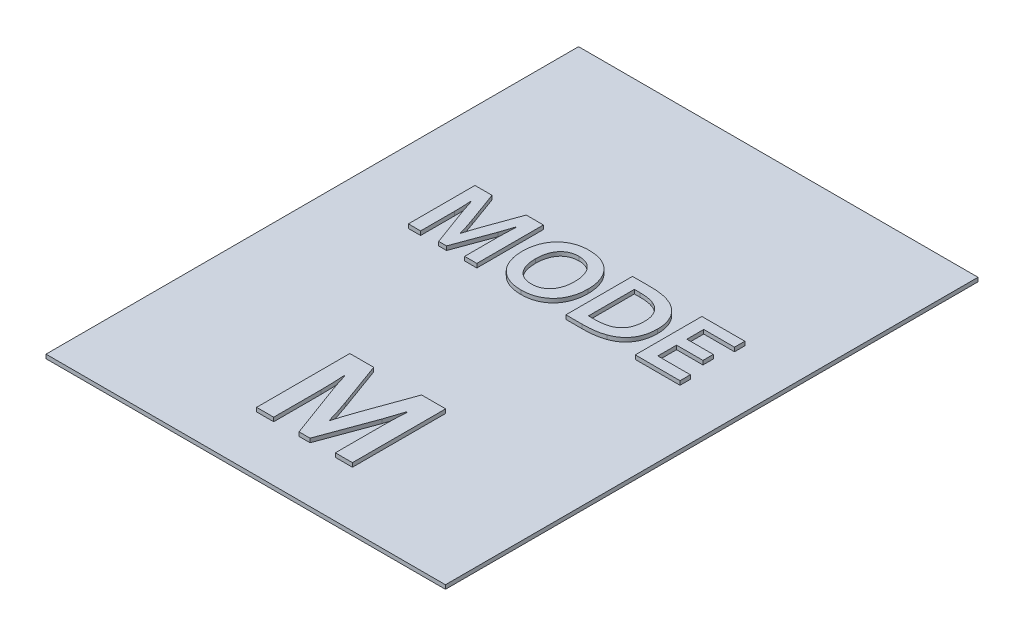
from build123d import *

# Parameters (mm, degrees)
SKETCH1_W           = 15
SKETCH1_H           = 20
BOSS_EXTRUDE1_DEPTH = 0.15
BOSS_EXTRUDE2_DEPTH = 0.15


with BuildPart() as part:
    # Sketch1 → Boss-Extrude1 (new body)
    with BuildSketch(Plane(origin=(0, 0, 0), x_dir=(1, 0, 0), z_dir=(0, 1, 0))):
        with Locations((7.5, 10)):
            Rectangle(SKETCH1_W, SKETCH1_H)
    extrude(amount=BOSS_EXTRUDE1_DEPTH)

    # Sketch2 → Boss-Extrude2 (add)
    # profile 1 of 5: a face of its own
    with BuildSketch(Plane(origin=(0, 0.15, 0), x_dir=(1, 0, 0), z_dir=(0, 1, 0))):
        with BuildLine():
            add(Edge.make_bspline(
                [(4.007118805, 11.561710579), (4.021341988, 11.611856052), (4.05041214, 11.714346222), (4.100009995, 11.869769118), (4.15291887, 12.031022762), (4.191561657, 12.139658429), (4.211234122, 12.19496322)],
                knots=[0, 0, 0, 0, 0.939842652, 1.920903895, 2.941563291, 4, 4, 4, 4], degree=3))
            Line((4.211234122, 12.19496322), (4.644222678, 13.391045967))
            Line((4.644222678, 13.391045967), (5.28847884, 13.391045967))
            Line((5.28847884, 13.391045967), (5.28847884, 10.891045967))
            Line((5.28847884, 10.891045967), (4.830732361, 10.891045967))
            Line((4.830732361, 10.891045967), (4.830732361, 12.158101424))
            add(Edge.make_bspline(
                [(4.830732361, 12.158101424), (4.831168475, 12.206334896), (4.832075637, 12.306665611), (4.835791365, 12.46276872), (4.843308015, 12.630009749), (4.849529089, 12.745144369), (4.852739403, 12.804558291)],
                knots=[0, 0, 0, 0, 0.894747737, 1.861169783, 2.896280781, 4, 4, 4, 4], degree=3))
            Line((4.852739403, 12.804558291), (4.836234122, 12.804558291))
            add(Edge.make_bspline(
                [(4.836234122, 12.804558291), (4.824814517, 12.766737473), (4.800637232, 12.686664237), (4.760299667, 12.563219814), (4.717428899, 12.433900638), (4.686558981, 12.347124918), (4.671181305, 12.303898079)],
                knots=[0, 0, 0, 0, 0.899185574, 1.903731904, 2.955755803, 4, 4, 4, 4], degree=3))
            Line((4.671181305, 12.303898079), (4.151264931, 10.891045967))
            Line((4.151264931, 10.891045967), (3.855270213, 10.891045967))
            Line((3.855270213, 10.891045967), (3.33535384, 12.303898079))
            add(Edge.make_bspline(
                [(3.33535384, 12.303898079), (3.320047882, 12.347148821), (3.289302405, 12.43402771), (3.245362218, 12.562993107), (3.206066125, 12.686777658), (3.181779815, 12.766756654), (3.170301023, 12.804558291)],
                knots=[0, 0, 0, 0, 1.044229383, 2.097570722, 3.100827182, 4, 4, 4, 4], degree=3))
            Line((3.170301023, 12.804558291), (3.153245565, 12.804558291))
            add(Edge.make_bspline(
                [(3.153245565, 12.804558291), (3.156705648, 12.747899151), (3.163500161, 12.636638457), (3.170803503, 12.472489686), (3.174509644, 12.314185105), (3.175377403, 12.210553046), (3.175802784, 12.159751953)],
                knots=[0, 0, 0, 0, 1.055577018, 2.072820593, 3.055284423, 4, 4, 4, 4], degree=3))
            Line((3.175802784, 12.159751953), (3.175802784, 10.891045967))
            Line((3.175802784, 10.891045967), (2.718056305, 10.891045967))
            Line((2.718056305, 10.891045967), (2.718056305, 13.391045967))
            Line((2.718056305, 13.391045967), (3.35901141, 13.391045967))
            Line((3.35901141, 13.391045967), (3.791449791, 12.201015157))
            add(Edge.make_bspline(
                [(3.791449791, 12.201015157), (3.809403487, 12.150639986), (3.845853326, 12.048367627), (3.898267901, 11.891513646), (3.948183789, 11.72869774), (3.97962566, 11.61788637), (3.995565107, 11.561710579)],
                knots=[0, 0, 0, 0, 0.956008945, 1.940902413, 2.956141108, 4, 4, 4, 4], degree=3))
            Line((3.995565107, 11.561710579), (4.007118805, 11.561710579))
        make_face()
    # profile 2 of 5: a face of its own
    with BuildSketch(Plane(origin=(0, 0.15, 0), x_dir=(1, 0, 0), z_dir=(0, 1, 0))):
        with BuildLine():
            add(Edge.make_bspline(
                [(8.211014051, 12.141045967), (8.210147117, 12.094785664), (8.208446047, 12.004015145), (8.192571627, 11.870774254), (8.167033635, 11.743308394), (8.130576769, 11.622245965), (8.085170064, 11.508049597), (8.029874149, 11.401565907), (7.96489408, 11.303354273), (7.890223995, 11.213615962), (7.80625788, 11.133234992), (7.713650448, 11.061292854), (7.611365444, 11.000085108), (7.500962753, 10.947253873), (7.381777038, 10.906002641), (7.254276069, 10.877160108), (7.119058203, 10.859208259), (7.026175645, 10.85697707), (6.978619685, 10.855834699)],
                knots=[0, 0, 0, 0, 1.10397319, 2.166181668, 3.19823321, 4.203814349, 5.180208902, 6.127974338, 7.062953007, 7.986182927, 8.908904057, 9.832766977, 10.779571297, 11.748942224, 12.749986143, 13.783327641, 14.865061606, 16, 16, 16, 16], degree=3))
            add(Edge.make_bspline(
                [(6.978619685, 10.855834699), (6.931063561, 10.856976815), (6.838180683, 10.859207505), (6.702965098, 10.877162906), (6.575456003, 10.905992787), (6.456299157, 10.947288967), (6.345935231, 10.999892262), (6.244019304, 11.061650104), (6.151003114, 11.133019961), (6.067034074, 11.213645162), (5.992353866, 11.303351543), (5.927310857, 11.401546833), (5.872252281, 11.508191917), (5.825794124, 11.622006391), (5.790434108, 11.743436063), (5.764601351, 11.870753029), (5.748810891, 12.004020761), (5.747098183, 12.09478756), (5.746225319, 12.141045967)],
                knots=[0, 0, 0, 0, 1.13493026, 2.216656473, 3.249990565, 4.25102731, 5.22039129, 6.163446387, 7.090771268, 8.013485786, 8.936709089, 9.871681058, 10.819439701, 11.79746504, 12.80178971, 13.833833857, 14.896034721, 16, 16, 16, 16], degree=3))
            add(Edge.make_bspline(
                [(5.746225319, 12.141045967), (5.747111553, 12.187302543), (5.748853985, 12.278247971), (5.764481637, 12.411542646), (5.79052235, 12.538821448), (5.825784352, 12.660087392), (5.872254756, 12.773899596), (5.927310305, 12.88054502), (5.992353669, 12.978741105), (6.067035383, 13.06844403), (6.15099806, 13.149082257), (6.244038448, 13.220402945), (6.34579451, 13.282308455), (6.456442098, 13.334157038), (6.575515918, 13.375425364), (6.702883887, 13.40510903), (6.838191439, 13.422834481), (6.931067204, 13.425098205), (6.978619685, 13.426257234)],
                knots=[0, 0, 0, 0, 1.104021813, 2.170626186, 3.19843321, 4.202809312, 5.180884735, 6.128691913, 7.063711762, 7.986982344, 8.909744114, 9.837116483, 10.780219874, 11.74776306, 12.748851068, 13.783230012, 14.86501162, 16, 16, 16, 16], degree=3))
            add(Edge.make_bspline(
                [(6.978619685, 13.426257234), (7.026172002, 13.425097949), (7.119047446, 13.422833725), (7.254357283, 13.405111835), (7.381717106, 13.375415479), (7.500819829, 13.334192175), (7.611506665, 13.282116544), (7.713631369, 13.22076032), (7.806262921, 13.148867203), (7.890222687, 13.068473231), (7.964894279, 12.978738375), (8.029874694, 12.880525944), (8.085167619, 12.774041925), (8.13058642, 12.65984778), (8.166944193, 12.538948742), (8.192691146, 12.411521359), (8.20840298, 12.278253596), (8.210133749, 12.18730444), (8.211014051, 12.141045967)],
                knots=[0, 0, 0, 0, 1.134996515, 2.216785876, 3.251172233, 4.252267416, 5.219817536, 6.166670343, 7.090580574, 8.013348957, 8.936626156, 9.871652706, 10.819466677, 11.795911232, 12.801543866, 13.829358257, 14.895970275, 16, 16, 16, 16], degree=3))
        make_face()
        with BuildLine():
            add(Edge.make_bspline(
                [(7.718056305, 12.141045967), (7.717508206, 12.177384681), (7.716445537, 12.247839168), (7.705815337, 12.350122415), (7.688520316, 12.445295702), (7.664148515, 12.533409626), (7.634040847, 12.614473334), (7.598079761, 12.688687997), (7.557151631, 12.756212453), (7.50975575, 12.815797198), (7.458588812, 12.869199293), (7.402278065, 12.91510631), (7.340935992, 12.953354001), (7.275437188, 12.984767708), (7.205745826, 13.008815753), (7.133016217, 13.026461117), (7.056886151, 13.0372681), (7.005064078, 13.038370662), (6.978619685, 13.038933291)],
                knots=[0, 0, 0, 0, 1.326027526, 2.570938252, 3.748651103, 4.853004742, 5.903648558, 6.900610549, 7.859261004, 8.779270952, 9.673995906, 10.554280722, 11.42350071, 12.306758397, 13.200155178, 14.109361998, 15.035222432, 16, 16, 16, 16], degree=3))
            add(Edge.make_bspline(
                [(6.978619685, 13.038933291), (6.95217531, 13.038370645), (6.900353271, 13.037268051), (6.824222954, 13.026461302), (6.751494269, 13.008815079), (6.681799537, 12.984770169), (6.616313064, 12.95334499), (6.554925587, 12.915139537), (6.498687606, 12.868991218), (6.446864541, 12.816176873), (6.400185698, 12.755987192), (6.359115001, 12.688724557), (6.32321138, 12.614462797), (6.293087142, 12.533412669), (6.268720143, 12.44529481), (6.251423717, 12.350122675), (6.24079392, 12.247839096), (6.239731194, 12.177384656), (6.239183065, 12.141045967)],
                knots=[0, 0, 0, 0, 0.964744669, 1.890573531, 2.799749348, 3.693115665, 4.576343233, 5.44553358, 6.325788378, 7.225153193, 8.141006995, 9.09962476, 10.096552755, 11.147160744, 12.251476725, 13.429149416, 14.674017691, 16, 16, 16, 16], degree=3))
            add(Edge.make_bspline(
                [(6.239183065, 12.141045967), (6.239732702, 12.104707672), (6.240798353, 12.034253997), (6.251407612, 11.931965044), (6.268807312, 11.836637527), (6.292998534, 11.74828988), (6.323106322, 11.667213135), (6.359094903, 11.593332824), (6.400373525, 11.526598812), (6.446668753, 11.466465944), (6.498861219, 11.414169047), (6.555074665, 11.368130544), (6.616121184, 11.329140481), (6.681954139, 11.298123265), (6.75127263, 11.272877209), (6.824382437, 11.256602658), (6.900282907, 11.244568306), (6.952160276, 11.243634777), (6.978619685, 11.243158643)],
                knots=[0, 0, 0, 0, 1.326383379, 2.571628189, 3.749657091, 4.860761826, 5.911687593, 6.902896967, 7.856106969, 8.77223779, 9.667102655, 10.547623704, 11.420653433, 12.304148151, 13.200014488, 14.107911086, 15.034963524, 16, 16, 16, 16], degree=3))
            add(Edge.make_bspline(
                [(6.978619685, 11.243158643), (7.005079111, 11.243634761), (7.056956515, 11.244568257), (7.132856734, 11.256602844), (7.205967463, 11.27287653), (7.275282585, 11.298125747), (7.341127867, 11.3291314), (7.402128902, 11.368164128), (7.458414037, 11.413960225), (7.509953559, 11.466845798), (7.556962311, 11.526374439), (7.598100252, 11.593369135), (7.634145874, 11.667202601), (7.664237097, 11.74829295), (7.68843315, 11.836636631), (7.705831441, 11.931965304), (7.716441104, 12.034253926), (7.717506697, 12.104707648), (7.718056305, 12.141045967)],
                knots=[0, 0, 0, 0, 0.965070905, 1.892156417, 2.800085406, 3.695983705, 4.579509943, 5.452570818, 6.333123281, 7.223323078, 8.143612752, 9.096856762, 10.088101498, 11.139064759, 12.250209134, 13.428280064, 14.6735693, 16, 16, 16, 16], degree=3))
        make_face(mode=Mode.SUBTRACT)
    # profile 3 of 5: a face of its own
    with BuildSketch(Plane(origin=(0, 0.15, 0), x_dir=(1, 0, 0), z_dir=(0, 1, 0))):
        with BuildLine():
            Line((8.633549262, 10.891045967), (8.633549262, 13.391045967))
            Line((8.633549262, 13.391045967), (9.304764051, 13.391045967))
            add(Edge.make_bspline(
                [(9.304764051, 13.391045967), (9.334663027, 13.39091661), (9.395044312, 13.390655374), (9.485853831, 13.385887703), (9.576153443, 13.379078446), (9.664538801, 13.3688892), (9.750297348, 13.357075276), (9.832708948, 13.342293642), (9.910806888, 13.325376469), (9.960292541, 13.310307492), (9.984231481, 13.303017798)],
                knots=[0, 0, 0, 0, 1.043593946, 2.10754854, 3.173523578, 4.204294749, 5.212878915, 6.194903184, 7.126775134, 8, 8, 8, 8], degree=3))
            add(Edge.make_bspline(
                [(9.984231481, 13.303017798), (10.017210167, 13.291885144), (10.081953721, 13.270029588), (10.175052727, 13.230532909), (10.261387155, 13.183793332), (10.342677312, 13.132867937), (10.417590686, 13.076142253), (10.486111508, 13.014166139), (10.54861414, 12.94758019), (10.604145316, 12.875636442), (10.653952116, 12.799639428), (10.696833682, 12.719090557), (10.733369304, 12.634234784), (10.763539087, 12.545196042), (10.787218528, 12.451922692), (10.804090005, 12.354815648), (10.814983492, 12.25389714), (10.816087057, 12.185272044), (10.816647854, 12.15039896)],
                knots=[0, 0, 0, 0, 1.089186224, 2.138283641, 3.160292024, 4.158706084, 5.137912795, 6.096978333, 7.047244128, 7.992138446, 8.937782078, 9.887874514, 10.844274186, 11.826235823, 12.827154491, 13.85289531, 14.908909893, 16, 16, 16, 16], degree=3))
            add(Edge.make_bspline(
                [(10.816647854, 12.15039896), (10.81619813, 12.117182269), (10.815314415, 12.051911022), (10.805975114, 11.955481703), (10.792032271, 11.862269136), (10.772025249, 11.772249398), (10.747161453, 11.685536939), (10.714856938, 11.602992293), (10.677529955, 11.523910867), (10.634044617, 11.448905717), (10.584161993, 11.378184175), (10.528566438, 11.31142004), (10.46664656, 11.249105936), (10.398866467, 11.191166317), (10.324484504, 11.138011044), (10.243734334, 11.089787046), (10.156348741, 11.046498631), (10.094834967, 11.022616453), (10.063456833, 11.010434171)],
                knots=[0, 0, 0, 0, 1.086887555, 2.135748769, 3.168058729, 4.170063808, 5.152092151, 6.117449806, 7.067931046, 8.012022167, 8.951272991, 9.89736566, 10.852385093, 11.823139696, 12.812606439, 13.84101728, 14.898704396, 16, 16, 16, 16], degree=3))
            add(Edge.make_bspline(
                [(10.063456833, 11.010434171), (10.035877938, 11.000723171), (9.979251234, 10.980783939), (9.890151096, 10.957133336), (9.795742531, 10.936825713), (9.695916187, 10.919736571), (9.590197179, 10.90639559), (9.477974686, 10.898308968), (9.359495104, 10.891566868), (9.278183168, 10.891222383), (9.23654222, 10.891045967)],
                knots=[0, 0, 0, 0, 0.835398993, 1.715293255, 2.632340385, 3.594875658, 4.609085711, 5.676420896, 6.810063539, 8, 8, 8, 8], degree=3))
            Line((9.23654222, 10.891045967), (8.633549262, 10.891045967))
        make_face()
        with BuildLine():
            add(Edge.make_bspline(
                [(9.281656657, 11.27836991), (9.314489143, 11.278683359), (9.378359464, 11.279293124), (9.471448983, 11.284103457), (9.559002381, 11.292938607), (9.641086715, 11.304934622), (9.717567847, 11.320093019), (9.788417345, 11.339029384), (9.854231096, 11.36038236), (9.895064491, 11.378870036), (9.914909298, 11.387854946)],
                knots=[0, 0, 0, 0, 1.216660131, 2.36681661, 3.452842549, 4.476429291, 5.440052605, 6.340109689, 7.193302415, 8, 8, 8, 8], degree=3))
            add(Edge.make_bspline(
                [(9.914909298, 11.387854946), (9.931398167, 11.396178779), (9.964020486, 11.412647024), (10.009433605, 11.442179342), (10.052413658, 11.473765149), (10.09223102, 11.508078953), (10.129054207, 11.545411309), (10.162386288, 11.585457219), (10.193003518, 11.628247535), (10.220477924, 11.673839239), (10.244813178, 11.722816874), (10.266332742, 11.774734185), (10.283633304, 11.830296058), (10.298879008, 11.888561303), (10.30939196, 11.950469471), (10.317812428, 12.015416746), (10.322780441, 12.083750633), (10.323382382, 12.130401357), (10.323690107, 12.154250192)],
                knots=[0, 0, 0, 0, 0.961643136, 1.902557943, 2.817899626, 3.739205806, 4.637788669, 5.546725084, 6.450827767, 7.376631405, 8.316672613, 9.297862575, 10.30104246, 11.346161031, 12.433195875, 13.569702801, 14.75758074, 16, 16, 16, 16], degree=3))
            add(Edge.make_bspline(
                [(10.323690107, 12.154250192), (10.323211455, 12.179016024), (10.322273965, 12.227522446), (10.316608046, 12.29838448), (10.305227757, 12.365383385), (10.290634913, 12.42869271), (10.271684271, 12.488583752), (10.24939173, 12.545192506), (10.222803054, 12.598351781), (10.192447455, 12.647929937), (10.158765003, 12.694264844), (10.122010789, 12.737566253), (10.080747277, 12.776543823), (10.036834096, 12.81304111), (9.989422461, 12.845986772), (9.939058333, 12.875603717), (9.886211418, 12.903040873), (9.849023765, 12.918011813), (9.830182185, 12.925597023)],
                knots=[0, 0, 0, 0, 1.211129113, 2.372120613, 3.47189722, 4.531188705, 5.546525523, 6.540652967, 7.503134403, 8.448971039, 9.379896832, 10.301969689, 11.221597421, 12.151615773, 13.091952693, 14.040845077, 15.007370132, 16, 16, 16, 16], degree=3))
            add(Edge.make_bspline(
                [(9.830182185, 12.925597023), (9.792464865, 12.938238416), (9.714154299, 12.964485102), (9.610235053, 12.983045181), (9.521306788, 12.993830951), (9.449371996, 12.999929014), (9.373382325, 13.003087644), (9.321455488, 13.003507164), (9.294860882, 13.003722023)],
                knots=[0, 0, 0, 0, 1.315300483, 2.730891928, 3.483105346, 4.281150212, 5.119681927, 6, 6, 6, 6], degree=3))
            Line((9.294860882, 13.003722023), (9.091295741, 13.003722023))
            Line((9.091295741, 13.003722023), (9.091295741, 11.27836991))
            Line((9.091295741, 11.27836991), (9.281656657, 11.27836991))
        make_face(mode=Mode.SUBTRACT)
    # profile 4 of 5: a face of its own
    with BuildSketch(Plane(origin=(0, 0.15, 0), x_dir=(1, 0, 0), z_dir=(0, 1, 0))):
        Polygon((11.696929544, 11.27836991), (12.918870565, 11.27836991), (12.918870565, 10.891045967), (11.239183065, 10.891045967), (11.239183065, 13.391045967), (12.851749086, 13.391045967), (12.851749086, 13.003722023), (11.696929544, 13.003722023), (11.696929544, 12.369919206), (12.688346798, 12.369919206), (12.688346798, 11.982595263), (11.696929544, 11.982595263), align=None)
    # profile 5 of 5: a face of its own
    with BuildSketch(Plane(origin=(0, 0.15, 0), x_dir=(1, 0, 0), z_dir=(0, 1, 0))):
        with BuildLine():
            add(Edge.make_bspline(
                [(7.639388106, 3.013799413), (7.659300563, 3.084003074), (7.699998776, 3.227489312), (7.769435773, 3.445081367), (7.843508197, 3.670836469), (7.897608099, 3.822926402), (7.925149549, 3.90035311)],
                knots=[0, 0, 0, 0, 0.939842652, 1.920903895, 2.941563291, 4, 4, 4, 4], degree=3))
            Line((7.925149549, 3.90035311), (8.531333528, 5.574868955))
            Line((8.531333528, 5.574868955), (9.433292155, 5.574868955))
            Line((9.433292155, 5.574868955), (9.433292155, 2.074868955))
            Line((9.433292155, 2.074868955), (8.792447085, 2.074868955))
            Line((8.792447085, 2.074868955), (8.792447085, 3.848746596))
            add(Edge.make_bspline(
                [(8.792447085, 3.848746596), (8.793057644, 3.916273456), (8.794327671, 4.056736457), (8.79952969, 4.27528081), (8.810053001, 4.509418251), (8.818762503, 4.670606718), (8.823256944, 4.753786209)],
                knots=[0, 0, 0, 0, 0.894747737, 1.861169783, 2.896280781, 4, 4, 4, 4], degree=3))
            Line((8.823256944, 4.753786209), (8.800149549, 4.753786209))
            add(Edge.make_bspline(
                [(8.800149549, 4.753786209), (8.784162103, 4.700837063), (8.750313905, 4.588734534), (8.693841313, 4.415912341), (8.633822238, 4.234865494), (8.590604353, 4.113379487), (8.569075606, 4.052861913)],
                knots=[0, 0, 0, 0, 0.899185574, 1.903731904, 2.955755803, 4, 4, 4, 4], degree=3))
            Line((8.569075606, 4.052861913), (7.841192683, 2.074868955))
            Line((7.841192683, 2.074868955), (7.426800078, 2.074868955))
            Line((7.426800078, 2.074868955), (6.698917155, 4.052861913))
            add(Edge.make_bspline(
                [(6.698917155, 4.052861913), (6.677488813, 4.113412951), (6.634445146, 4.235043395), (6.572928885, 4.415594951), (6.517914354, 4.588893322), (6.48391352, 4.700863918), (6.467843211, 4.753786209)],
                knots=[0, 0, 0, 0, 1.044229383, 2.097570722, 3.100827182, 4, 4, 4, 4], degree=3))
            Line((6.467843211, 4.753786209), (6.44396557, 4.753786209))
            add(Edge.make_bspline(
                [(6.44396557, 4.753786209), (6.448809687, 4.674463413), (6.458322005, 4.518698441), (6.468546683, 4.288890162), (6.473735281, 4.067263749), (6.474950143, 3.922178866), (6.475545676, 3.851057336)],
                knots=[0, 0, 0, 0, 1.055577018, 2.072820593, 3.055284423, 4, 4, 4, 4], degree=3))
            Line((6.475545676, 3.851057336), (6.475545676, 2.074868955))
            Line((6.475545676, 2.074868955), (5.834700606, 2.074868955))
            Line((5.834700606, 2.074868955), (5.834700606, 5.574868955))
            Line((5.834700606, 5.574868955), (6.732037754, 5.574868955))
            Line((6.732037754, 5.574868955), (7.337451486, 3.908825821))
            add(Edge.make_bspline(
                [(7.337451486, 3.908825821), (7.362586661, 3.838300582), (7.413616436, 3.695119279), (7.48699684, 3.475523707), (7.556879083, 3.247581438), (7.600897704, 3.09244552), (7.62321293, 3.013799413)],
                knots=[0, 0, 0, 0, 0.956008945, 1.940902413, 2.956141108, 4, 4, 4, 4], degree=3))
            Line((7.62321293, 3.013799413), (7.639388106, 3.013799413))
        make_face()
    extrude(amount=BOSS_EXTRUDE2_DEPTH)


solid = part.part
